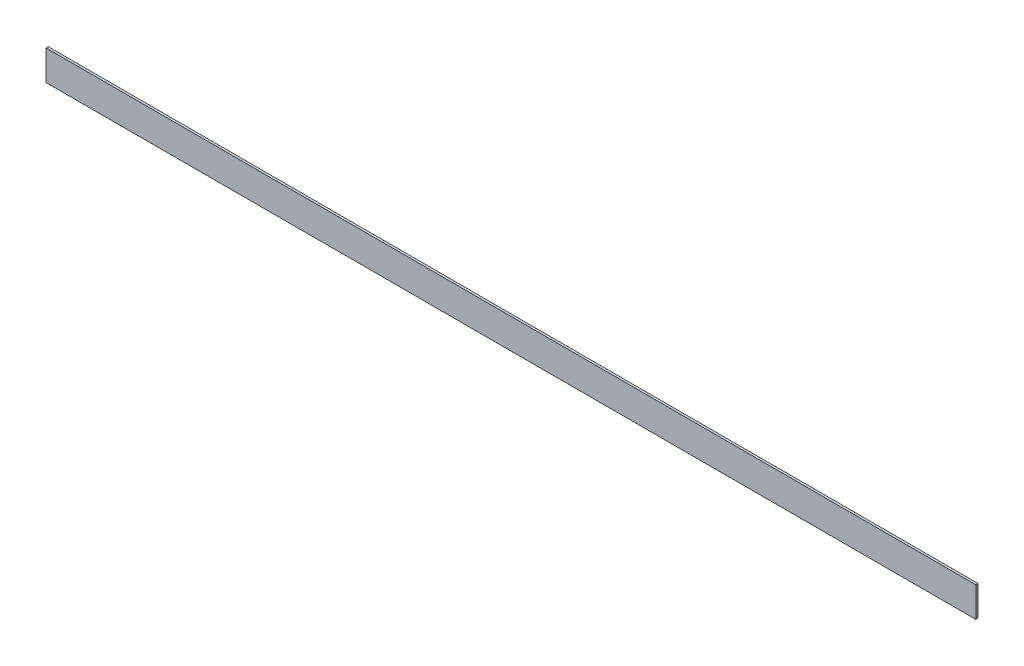
from build123d import *

# Parameters (mm, degrees)
PRESS_TEPSI_RAFI_RAF_BUK_ON_1_START = -20
SKETCH1_W                           = 620
SKETCH1_H                           = 20
PRESS_TEPSI_RAFI_RAF_BUK_ON_1_DEPTH = 1.5


with BuildPart() as part:
    # Sketch1 → PRESS_tepsi_rafi_raf_buk_on_1 (new body)
    with BuildSketch(Plane.XY.offset(PRESS_TEPSI_RAFI_RAF_BUK_ON_1_START)):
        with Locations((350, 1062)):
            Rectangle(SKETCH1_W, SKETCH1_H)
    extrude(amount=-PRESS_TEPSI_RAFI_RAF_BUK_ON_1_DEPTH)


solid = part.part
